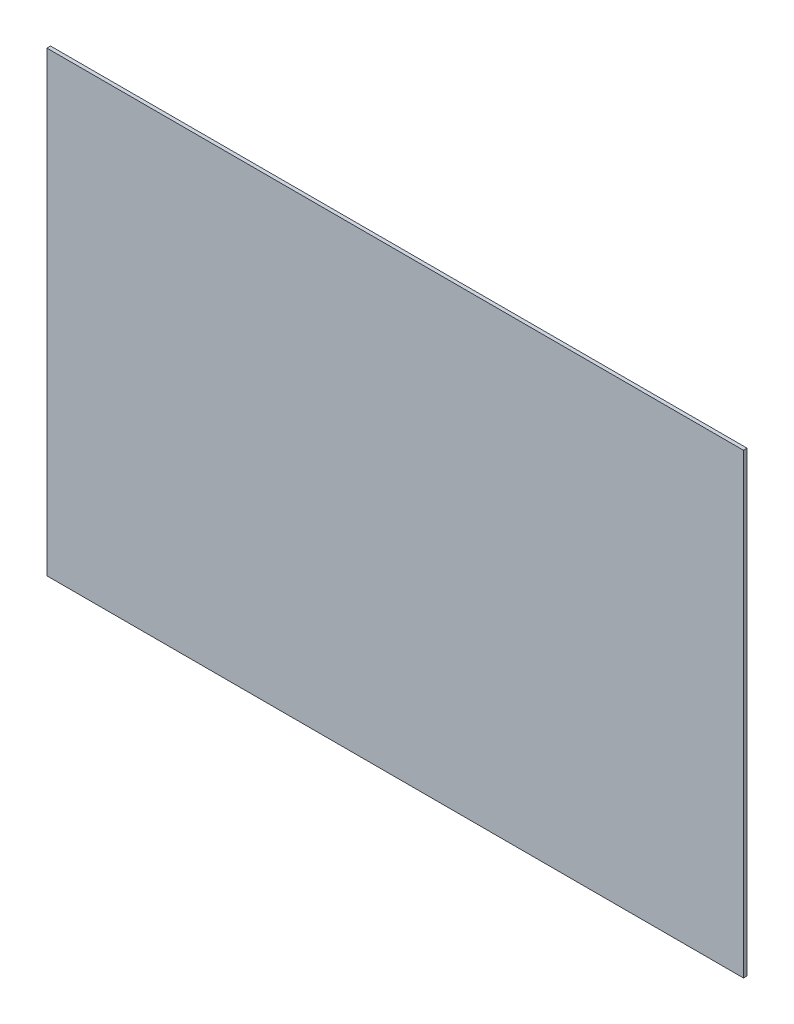
from build123d import *

# Parameters (mm, degrees)
SKETCH1_W           = 1219.2
SKETCH1_H           = 800
BOSS_EXTRUDE1_DEPTH = 6.35


with BuildPart() as part:
    # Sketch1 → Boss-Extrude1 (new body)
    with BuildSketch(Plane.XY):
        with Locations((609.6, 400)):
            Rectangle(SKETCH1_W, SKETCH1_H)
    extrude(amount=BOSS_EXTRUDE1_DEPTH)


solid = part.part
